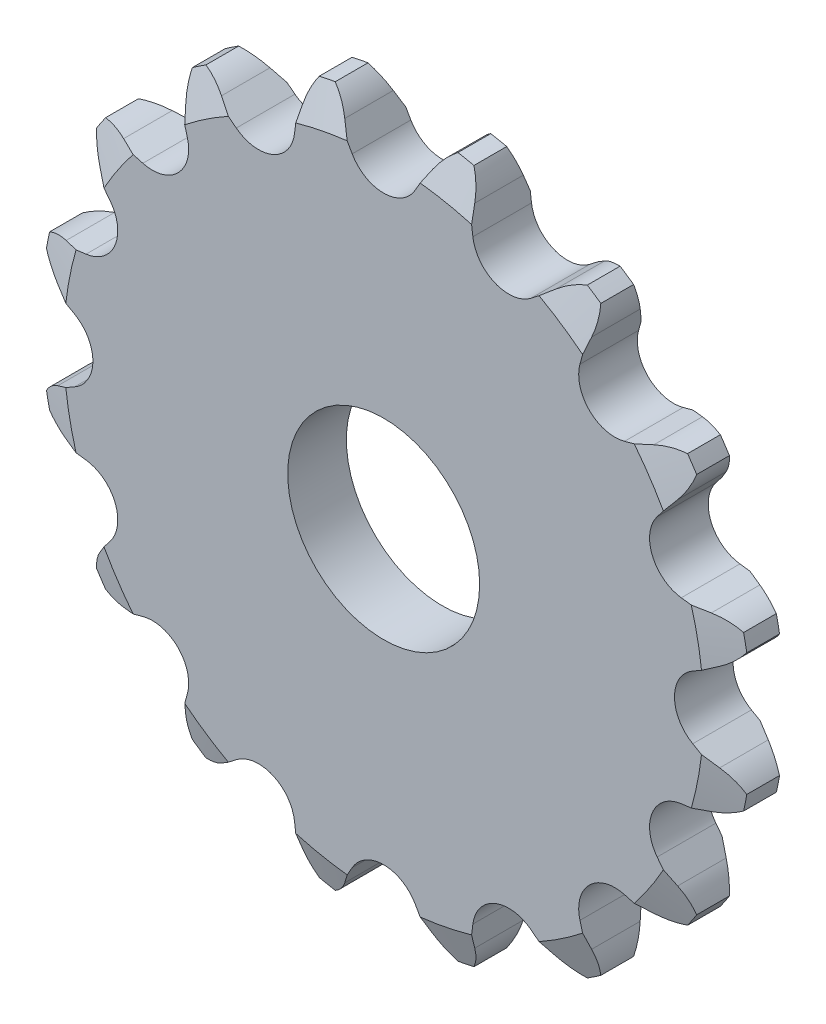
from build123d import *

# Parameters (mm, degrees)
SKETCH1_R         = 25.4
EXTRUDE1_DEPTH    = 2.0955
CHAMFER1_SIZE     = 2.54
CHAMFER1_SIZE2    = 0.924484395
CHAMFER2_SIZE     = 2.54
CHAMFER2_SIZE2    = 0.924484395
EXTRUDE2_DEPTH    = 36.982094439
CIRPATTERN1_COUNT = 16
SKETCH3_R         = 6.858
EXTRUDE3_DEPTH    = 36.629628383


with BuildPart() as part:
    # Sketch1 → Extrude1 (new, symmetric)
    with BuildSketch(Plane.XY):
        Circle(SKETCH1_R)
    extrude(amount=EXTRUDE1_DEPTH, both=True)

    # Chamfer1
    chamfer1_edges = [part.edges().sort_by_distance(p)[0] for p in [
        (-25.4, 0, 2.0955),
    ]]
    chamfer1_side = [part.faces().sort_by_distance(p)[0] for p in [
        (0, 0, 2.0955),
    ]]
    chamfer(chamfer1_edges, length=CHAMFER1_SIZE, length2=CHAMFER1_SIZE2, reference=chamfer1_side[0])

    # Chamfer2
    chamfer2_edges = [part.edges().sort_by_distance(p)[0] for p in [
        (-25.4, 0, -2.0955),
    ]]
    chamfer2_side = [part.faces().sort_by_distance(p)[0] for p in [
        (0, 0, -2.0955),
    ]]
    chamfer(chamfer2_edges, length=CHAMFER2_SIZE, length2=CHAMFER2_SIZE2, reference=chamfer2_side[0])

    # Sketch2 → Extrude2 (cut, symmetric)
    with BuildSketch(Plane.XY):
        with BuildLine():
            Line((-2.249924628, 22.08344412), (-3.141992287, 23.645917989))
            ThreePointArc((-3.141992287, 23.645917989), (-3.687863216, 24.399725688), (-4.382583323, 25.019052009))
            ThreePointArc((-4.382583323, 25.019052009), (0, 25.4), (4.382583323, 25.019052009))
            ThreePointArc((4.382583323, 25.019052009), (3.687863216, 24.399725688), (3.141992287, 23.645917989))
            Line((3.141992287, 23.645917989), (2.249924628, 22.08344412))
            ThreePointArc((2.249924628, 22.08344412), (0, 20.7772), (-2.249924628, 22.08344412))
        make_face()
    extrude2 = extrude(amount=EXTRUDE2_DEPTH, both=True, mode=Mode.SUBTRACT)

    # CirPattern1: Extrude2 ×16 about axis
    cirpattern1_axis = Axis((0, 0, 0), (0, 0, 1))
    for i in range(1, CIRPATTERN1_COUNT):
        add(extrude2.rotate(cirpattern1_axis, i * 360 / CIRPATTERN1_COUNT), mode=Mode.SUBTRACT)

    # Sketch3 → Extrude3 (cut, through all)
    with BuildSketch(Plane.XY.offset(2.0955)):
        Circle(SKETCH3_R)
    extrude(amount=-EXTRUDE3_DEPTH, mode=Mode.SUBTRACT)


solid = part.part
